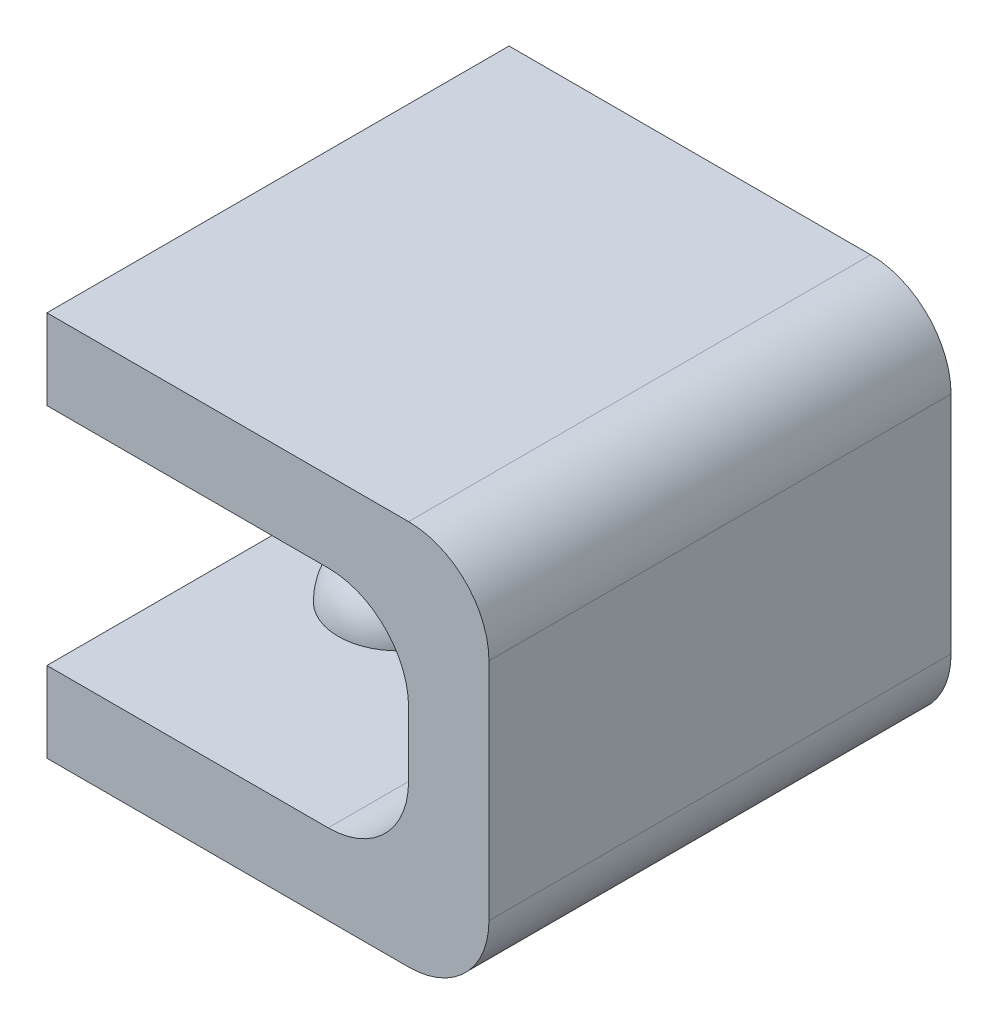
from build123d import *

# Parameters (mm, degrees)
BOSS_EXTRUDE1_DEPTH = 11.5
REVOLVE1_ANGLE      = 180
FILLET1_R           = 2


with BuildPart() as part:
    # Sketch1 → Boss-Extrude1 (new body)
    with BuildSketch(Plane.XY):
        Polygon((-9, 2.8), (0, 2.8), (0, -2.8), (-9, -2.8), (-9, -4.8), (2, -4.8), (2, 4.8), (-9, 4.8), align=None)
    extrude(amount=BOSS_EXTRUDE1_DEPTH)

    # Sketch2 → Revolve1 (revolve)
    with BuildSketch(Plane.XZ.offset(-2.8)):
        with BuildLine():
            Line((-6, 4.25), (-6, 7.25))
            ThreePointArc((-6, 7.25), (-7.5, 5.75), (-6, 4.25))
        make_face()
    revolve1 = revolve(axis=Axis((-6, 2.8, 4.25), (0, 0, 1)), revolution_arc=REVOLVE1_ANGLE)

    # Mirror1: Revolve1 across plane
    add(revolve1.mirror(Plane.ZX))

    # Fillet1
    fillet1_edges = [part.edges().sort_by_distance(p)[0] for p in [
        (2, 4.8, 5.75),
        (2, -4.8, 5.75),
        (0, -2.8, 5.75),
        (0, 2.8, 5.75),
    ]]
    fillet(fillet1_edges, radius=FILLET1_R)


solid = part.part
